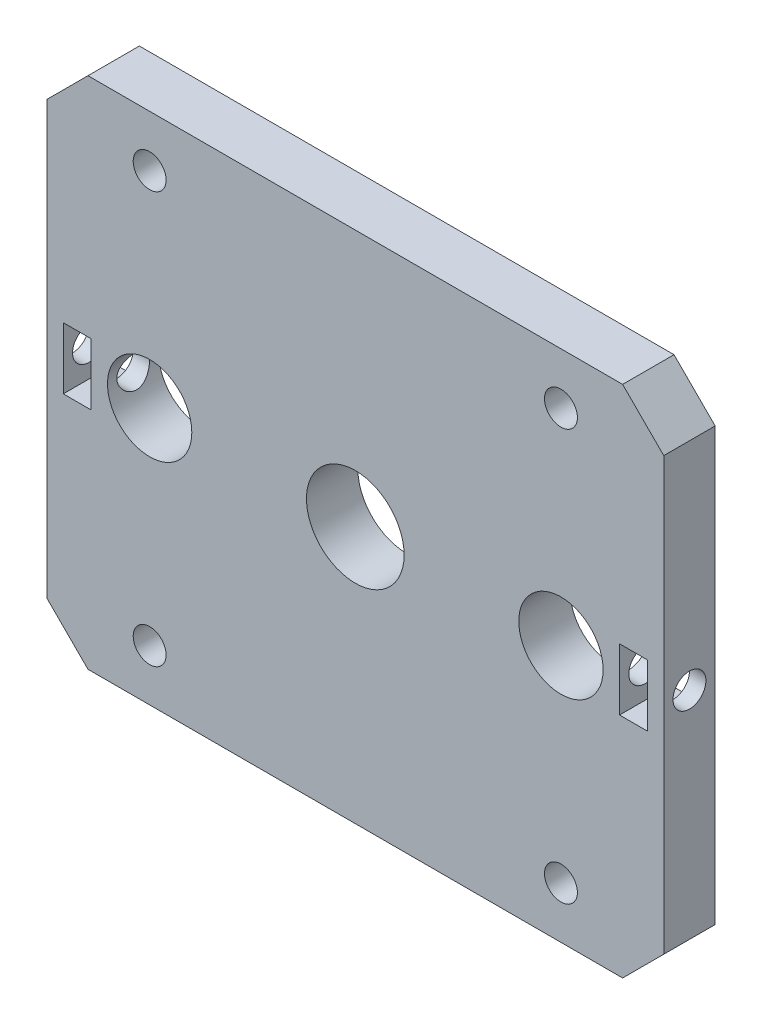
from build123d import *

# Parameters (mm, degrees)
SKETCH_1_W          = 60
SKETCH_1_H          = 50
EXTRUDE_1_DEPTH     = 5
HOLE_WIZARD_1_D     = 9.5
HOLE_WIZARD_1_DEPTH = 20
CHAMFER_1_SIZE      = 4
SKETCH_15_R         = 1.6
CUT_EXTRUDE_1_DEPTH = 40.37003937
HOLE_WIZARD_2_D     = 8.2
SKETCH_19_W         = 2.7
SKETCH_19_H         = 6
CUT_EXTRUDE_2_DEPTH = 10
HOLE_WIZARD_3_D     = 3.2
HOLE_WIZARD_3_DEPTH = 10


with BuildPart() as part:
    # 草图1 → 凸台-拉伸1 (new body)
    with BuildSketch(Plane.XY):
        Rectangle(SKETCH_1_W, SKETCH_1_H)
    extrude(amount=EXTRUDE_1_DEPTH)

    # 孔1
    with Locations(Plane.XY.offset(5)):
        with Locations((0, 0)):
            Hole(HOLE_WIZARD_1_D / 2, depth=HOLE_WIZARD_1_DEPTH)

    # 倒角1
    chamfer_1_edges = [part.edges().sort_by_distance(p)[0] for p in [
        (30, -25, 2.5),
        (-30, -25, 2.5),
        (-30, 25, 2.5),
        (30, 25, 2.5),
    ]]
    chamfer(chamfer_1_edges, length=CHAMFER_1_SIZE)

    # 草图15 → 切除-拉伸1 (cut, through all)
    with BuildSketch(Plane.XY.offset(5)):
        with BuildLine():
            ThreePointArc((-21.13137085, 21.13137085), (-21.13137085, 18.86862915), (-18.86862915, 18.86862915))
            Line((-18.86862915, 18.86862915), (-21.13137085, 21.13137085))
        make_face()
        with BuildLine():
            Line((-21.13137085, 21.13137085), (-18.86862915, 18.86862915))
            ThreePointArc((-18.86862915, 18.86862915), (-18.521792748, 19.387706508), (-18.4, 20))
            ThreePointArc((-18.4, 20), (-19.387706508, 21.478207252), (-21.13137085, 21.13137085))
        make_face()
        with Locations((20, 20)):
            Circle(SKETCH_15_R)
        with Locations((20, -20)):
            Circle(SKETCH_15_R)
        with Locations(Location((-20, -20, 0), (0, 0, 180))):
            Circle(SKETCH_15_R)
    extrude(amount=-CUT_EXTRUDE_1_DEPTH, mode=Mode.SUBTRACT)

    # 孔2 (through all)
    with Locations(Plane.XY.offset(5)):
        with Locations((-20, 0), (20, 0)):
            Hole(HOLE_WIZARD_2_D / 2)

    # 草图19 → 切除-拉伸2 (cut)
    with BuildSketch(Plane.XY.offset(5)):
        with Locations((27.05, 0)):
            Rectangle(SKETCH_19_W, SKETCH_19_H)
    cut_extrude_2 = extrude(amount=-CUT_EXTRUDE_2_DEPTH, mode=Mode.SUBTRACT)

    # 孔3
    with Locations(Plane(origin=(30, 0, 0), x_dir=(0, 0, -1), z_dir=(1, 0, 0))):
        with Locations((-2.5, 0)):
            hole_wizard_3 = Hole(HOLE_WIZARD_3_D / 2, depth=HOLE_WIZARD_3_DEPTH)

    # 镜向1: 切除-拉伸2, 孔3 across plane
    add(cut_extrude_2.mirror(Plane(origin=(0, 0, 0), x_dir=(0, 0, 1), z_dir=(1, 0, 0))), mode=Mode.SUBTRACT)
    add(hole_wizard_3.mirror(Plane(origin=(0, 0, 0), x_dir=(0, 0, 1), z_dir=(1, 0, 0))), mode=Mode.SUBTRACT)


solid = part.part
